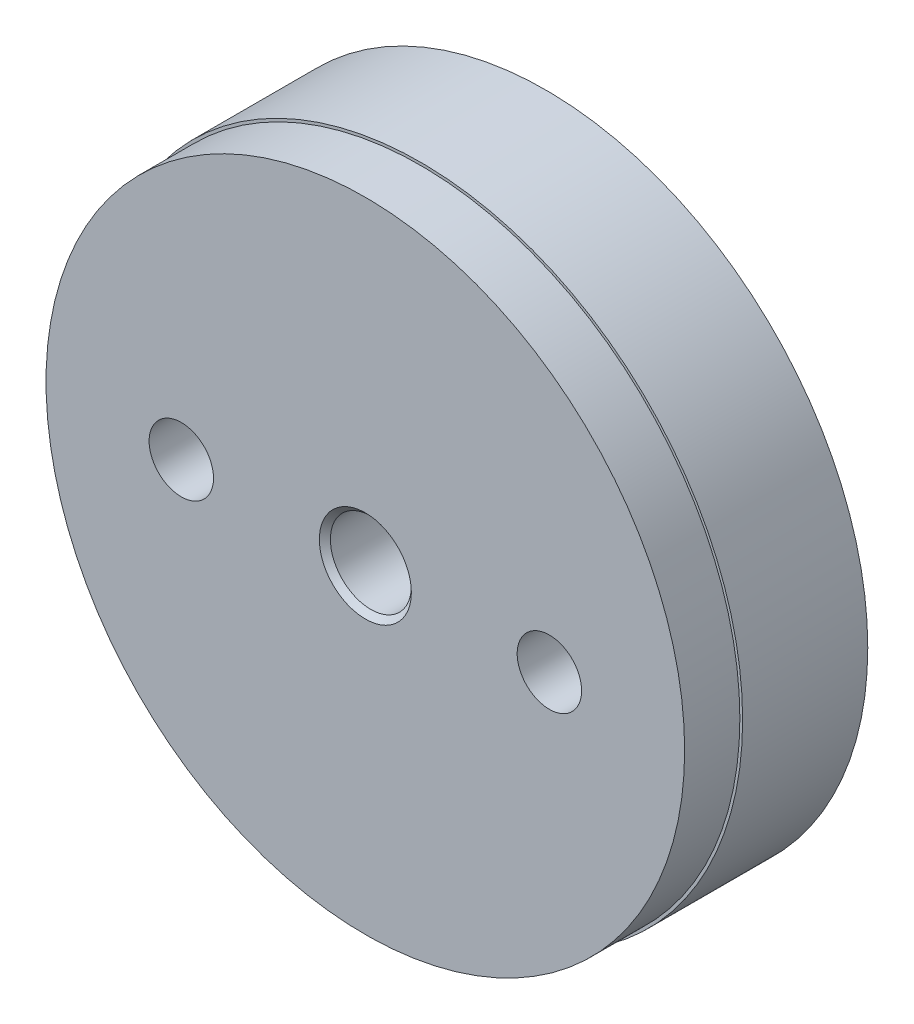
from build123d import *

# Parameters (mm, degrees)
SKETCH1_R           = 87.5
BOSS_EXTRUDE1_DEPTH = 49
CUT_EXTRUDE1_START  = -15
SKETCH2_R           = 87.5
SKETCH2_R_2         = 86.75
CUT_EXTRUDE1_DEPTH  = 15
M20_TAPPED_HOLE1_D  = 17.5


with BuildPart() as part:
    # Sketch1 → Boss-Extrude1 (new body)
    with BuildSketch(Plane.XY):
        Circle(SKETCH1_R)
    extrude(amount=BOSS_EXTRUDE1_DEPTH)

    # Sketch2 → Cut-Extrude1 (cut)
    with BuildSketch(Plane.XY.offset(49).offset(CUT_EXTRUDE1_START)):
        Circle(SKETCH2_R)
        Circle(SKETCH2_R_2, mode=Mode.SUBTRACT)
    extrude(amount=CUT_EXTRUDE1_DEPTH, mode=Mode.SUBTRACT)

    # M20 Tapped Hole1 (through all)
    with Locations(Plane.XY.offset(49)):
        with Locations((-50, 0), (50, 0)):
            Hole(M20_TAPPED_HOLE1_D / 2)

    # Sketch6 → Ø22.0 (22) Diameter Hole1 (revolve, cut)
    with BuildSketch(Plane(origin=(0, 0, 49), x_dir=(0, -1, 0), z_dir=(1, 0, 0))):
        Polygon((0, 0), (0, 49), (12.5, 49), (11, 47.5), (11, 1.5), (12.5, 0), align=None)
    revolve(axis=Axis((0, 0, 55.35), (0, 0, -1)), mode=Mode.SUBTRACT)


solid = part.part
